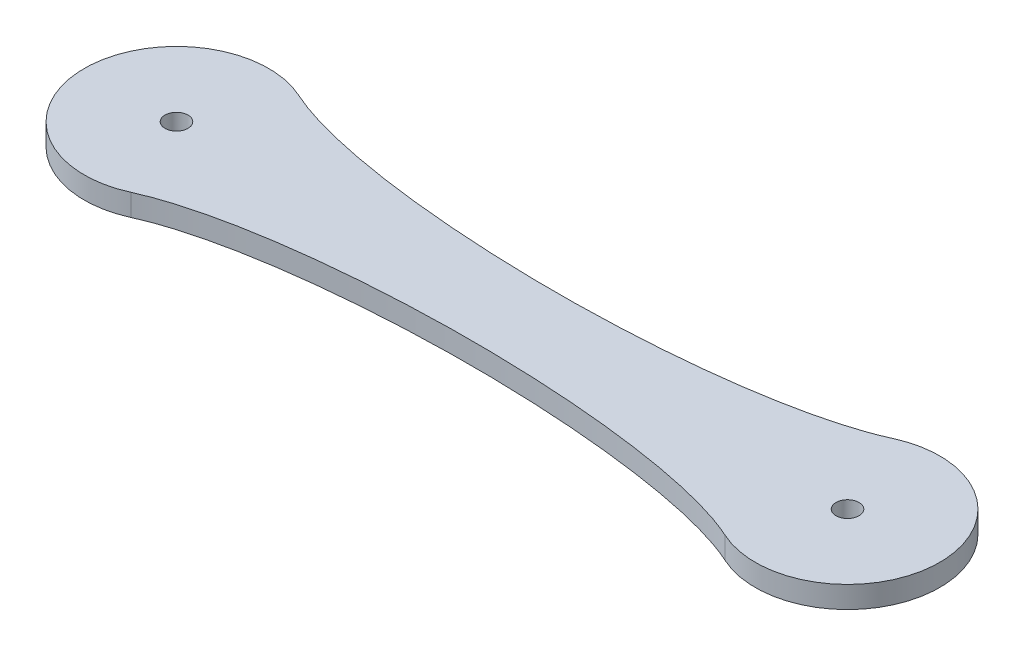
from build123d import *

# Parameters (mm, degrees)
BOSS_EXTRUDE1_DEPTH = 2.6
CUT_EXTRUDE1_REACH  = 93.699
SKETCH3_R           = 1.375


with BuildPart() as part:
    # Sketch1 → Boss-Extrude1 (new body)
    with BuildSketch(Plane(origin=(0, 0, 0), x_dir=(1, 0, 0), z_dir=(0, 1, 0))):
        with BuildLine():
            ThreePointArc((4.582575695, 10), (-11, 0), (4.582575695, -10))
            add(Edge.make_bspline(
                [(4.582575695, -10), (11.56314995, -6.801099008), (40.099315353, -3.216443036), (68.360107676, -6.765931234), (75.417424305, -10)],
                knots=[0, 0, 0, 0, 0.499463492, 1, 1, 1, 1], degree=3))
            ThreePointArc((75.417424305, -10), (91, 0), (75.417424305, 10))
            add(Edge.make_bspline(
                [(4.582575695, 10), (11.56314995, 6.801099008), (40.099315353, 3.216443036), (68.360107676, 6.765931234), (75.417424305, 10)],
                knots=[0, 0, 0, 0, 0.499463492, 1, 1, 1, 1], degree=3))
        make_face()
    extrude(amount=BOSS_EXTRUDE1_DEPTH)

    # Sketch3 → Cut-Extrude1 (cut, up to next)
    with BuildSketch(Plane(origin=(0, 2.6, 0), x_dir=(1, 0, 0), z_dir=(0, 1, 0)), mode=Mode.PRIVATE) as cut_extrude1_sk1:
        with Locations(Location((0, 0, 0), (0, 0, 270))):
            Circle(SKETCH3_R)
    cut_extrude1_tool1 = extrude(cut_extrude1_sk1.sketch, amount=-CUT_EXTRUDE1_REACH, mode=Mode.PRIVATE) & part.part
    # Sketch3 → Cut-Extrude1 (cut, up to next)
    with BuildSketch(Plane(origin=(0, 2.6, 0), x_dir=(1, 0, 0), z_dir=(0, 1, 0)), mode=Mode.PRIVATE) as cut_extrude1_sk2:
        with Locations(Location((80, 0, 0), (0, 0, 270))):
            Circle(SKETCH3_R)
    cut_extrude1_tool2 = extrude(cut_extrude1_sk2.sketch, amount=-CUT_EXTRUDE1_REACH, mode=Mode.PRIVATE) & part.part
    add(cut_extrude1_tool1.solids().sort_by_distance((0, 2.6, 0))[0], mode=Mode.SUBTRACT)
    add(cut_extrude1_tool2.solids().sort_by_distance((80, 2.6, 0))[0], mode=Mode.SUBTRACT)


solid = part.part
